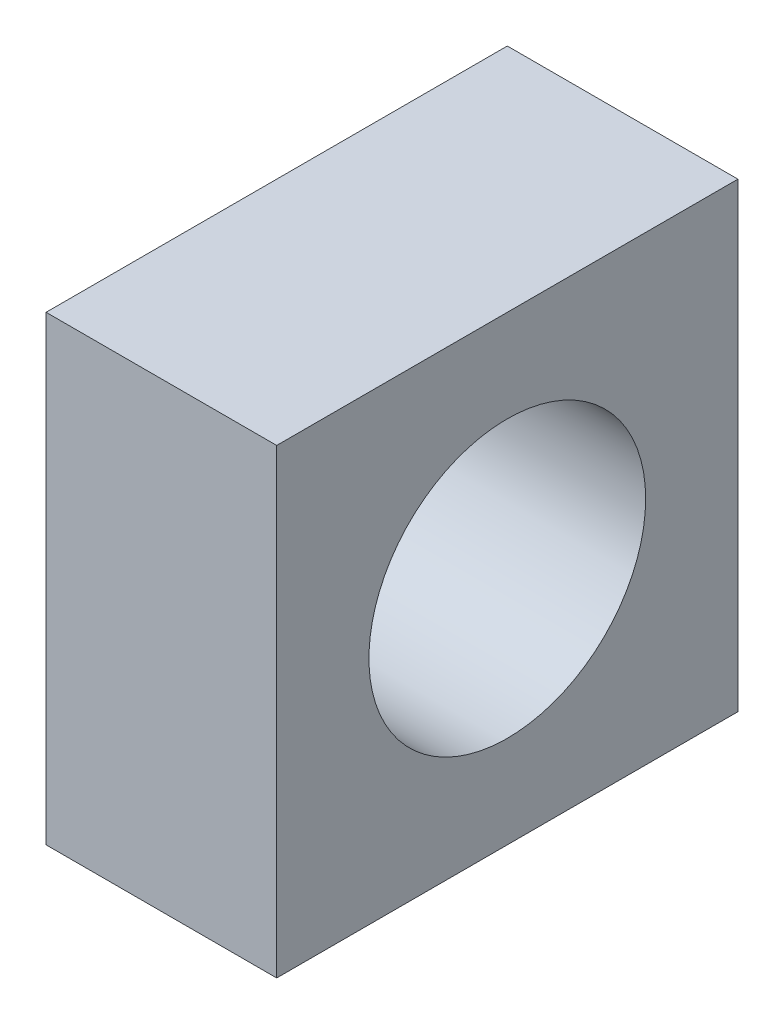
from build123d import *

# Parameters (mm, degrees)
SKETCH_1_W      = 2
SKETCH_1_H      = 2
SKETCH_1_R      = 0.6
EXTRUDE_2_DEPTH = 1


with BuildPart() as part:
    # 草图1 → 凸台-拉伸2 (new body)
    with BuildSketch(Plane(origin=(0, 0, 0), x_dir=(0, 0, -1), z_dir=(1, 0, 0))):
        Rectangle(SKETCH_1_W, SKETCH_1_H)
        Circle(SKETCH_1_R, mode=Mode.SUBTRACT)
    extrude(amount=EXTRUDE_2_DEPTH)


solid = part.part
